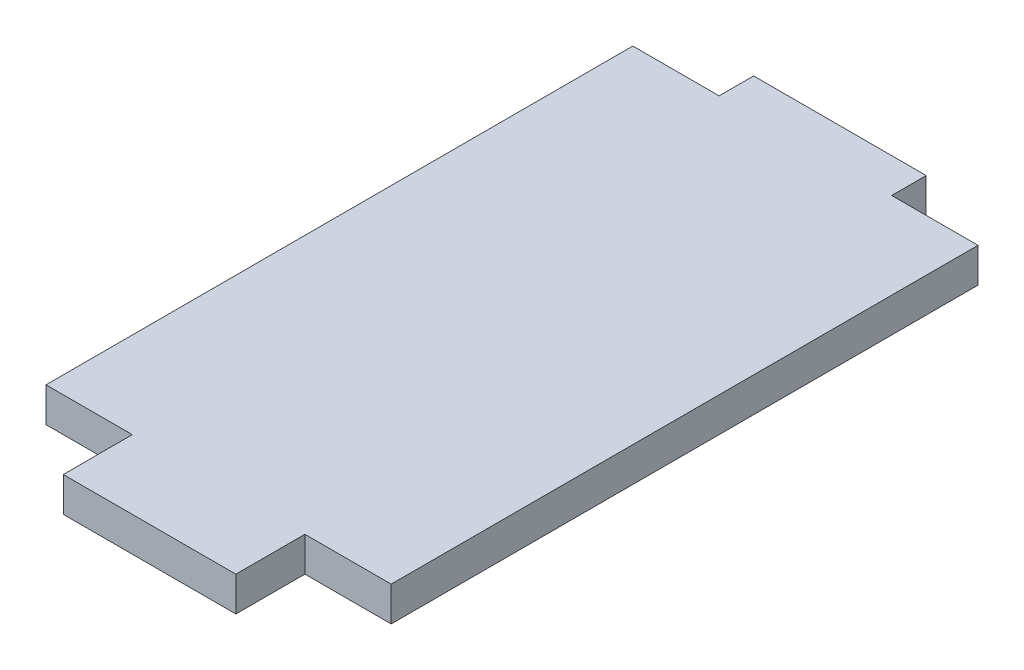
from build123d import *

# Parameters (mm, degrees)
SKETCH1_W           = 7.5
SKETCH1_H           = 6
BOSS_EXTRUDE1_DEPTH = 3


with BuildPart() as part:
    # Sketch1 → Boss-Extrude1 (new body)
    with BuildSketch(Plane(origin=(0, 0, 0), x_dir=(1, 0, 0), z_dir=(0, 1, 0))):
        Polygon((0, 0), (0, 25.5), (-7.5, 25.5), (-15, 25.5), (-15, -12.75), (0, -12.75), align=None)
        Polygon((0, -25.5), (0, -12.75), (-15, -12.75), (-15, -25.5), (-7.5, -25.5), align=None)
        Polygon((15, -12.75), (0, -12.75), (0, -25.5), (7.5, -25.5), (15, -25.5), align=None)
        Polygon((7.5, 25.5), (0, 25.5), (0, 0), (0, -12.75), (15, -12.75), (15, 25.5), align=None)
        Polygon((-7.5, 25.5), (0, 25.5), (7.5, 25.5), (7.5, 28.5), (-7.5, 28.5), align=None)
        Polygon((-7.5, 25.5), (0, 25.5), (7.5, 25.5), (7.5, 28.5), (-7.5, 28.5), align=None)
        with Locations((-3.75, -28.5)):
            Rectangle(SKETCH1_W, SKETCH1_H)
        with Locations((3.75, -28.5)):
            Rectangle(SKETCH1_W, SKETCH1_H)
    extrude(amount=BOSS_EXTRUDE1_DEPTH)


solid = part.part
